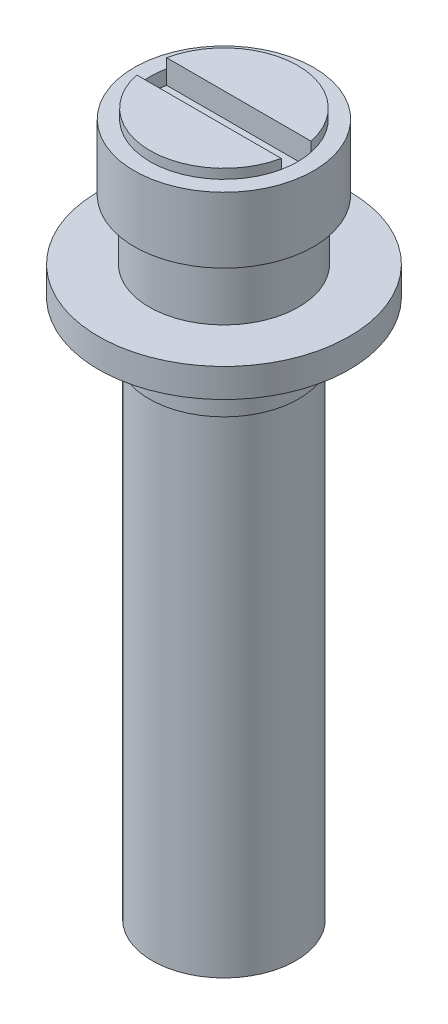
from build123d import *

# Parameters (mm, degrees)
ENL_V_START             = -2
ENL_V_MAT_EXTRU_1_DEPTH = 2


with BuildPart() as part:
    # Esquisse2 → Révolution1 (revolve)
    with BuildSketch(Plane.XY, mode=Mode.PRIVATE) as r_volution1_sk:
        Polygon((0, 64.893975029), (6.175, 64.893975029), (6.175, 64.093975029), (7.5, 64.093975029), (7.5, 58.593975029), (6.25, 58.593975029), (6.25, 53.593975029), (10.5, 53.593975029), (10.5, 51.193975029), (6.25, 51.193975029), (6.25, 46.933975029), (6, 46.933975029), (6, 6.093975029), (0, 6.093975029), align=None)
    revolve(r_volution1_sk.sketch.rotate(Axis((0, 0, 0), (0, 1, 0)), 90), axis=Axis((0, 0, 0), (0, 1, 0)))

    # Esquisse3 → Enlèv. mat.-Extru.1 (cut)
    with BuildSketch(Plane(origin=(0, 64.893975029, 0), x_dir=(1, 0, 0), z_dir=(0, 1, 0)).offset(ENL_V_START)):
        with BuildLine():
            Line((-6.047158424, 1.25), (6.047158424, 1.25))
            ThreePointArc((6.047158424, 1.25), (6.175, 0), (6.047158424, -1.25))
            Line((6.047158424, -1.25), (-6.047158424, -1.25))
            ThreePointArc((-6.047158424, -1.25), (-6.175, 0), (-6.047158424, 1.25))
        make_face()
    extrude(amount=ENL_V_MAT_EXTRU_1_DEPTH, mode=Mode.SUBTRACT)


solid = part.part
